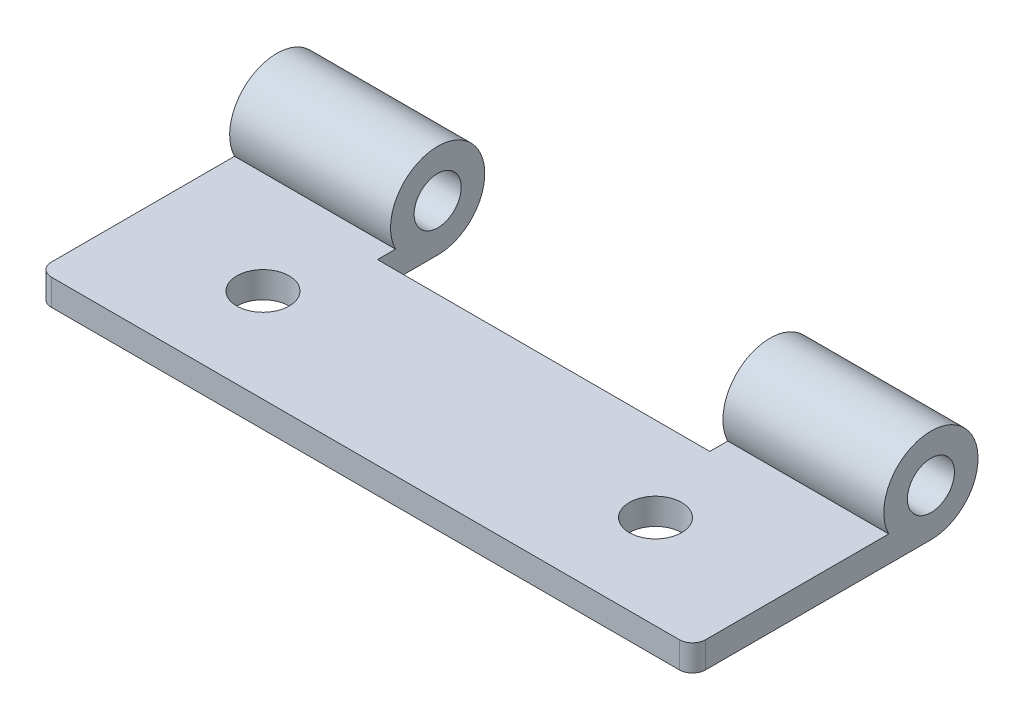
from build123d import *

# Parameters (mm, degrees)
BOSS_EXTRUDE1_DEPTH     = 25
CUT_EXTRUDE1_DEPTH      = 25
CUT_EXTRUDE1_DEPTH_BACK = 25
SKETCH4_R               = 0.9
CUT_EXTRUDE2_DEPTH      = 25
FILLET1_R               = 0.5
CUT_EXTRUDE3_DEPTH      = 25
CUT_EXTRUDE3_DEPTH_BACK = 25
SKETCH5_R               = 1


with BuildPart() as part:
    # Sketch2 → Boss-Extrude1 (new body)
    with BuildSketch(Plane(origin=(0, 0, 0), x_dir=(0, 0, -1), z_dir=(1, 0, 0))):
        with BuildLine():
            Line((0, -1.8), (-9.11245155, -1.8))
            Line((-9.11245155, -1.8), (-9.11245155, -0.8))
            Line((-9.11245155, -0.8), (-1.61245155, -0.8))
            ThreePointArc((-1.61245155, -0.8), (0.948683298, 1.529705854), (0, -1.8))
        make_face()
    extrude(amount=BOSS_EXTRUDE1_DEPTH)

    # Sketch3 → Cut-Extrude1 (cut, two sides: drawn at the far end of the back side and taken through both)
    with BuildSketch(Plane(origin=(0, 0, 0), x_dir=(1, 0, 0), z_dir=(0, 1, 0)).offset(-CUT_EXTRUDE1_DEPTH_BACK)):
        Polygon((18.85, 2.515210703), (6.15, 2.515210703), (6.15, -2.3), (12.5, -2.3), (18.85, -2.3), align=None)
    extrude(amount=CUT_EXTRUDE1_DEPTH + CUT_EXTRUDE1_DEPTH_BACK, mode=Mode.SUBTRACT)

    # Sketch4 → Cut-Extrude2 (cut)
    with BuildSketch(Plane(origin=(25, 0, 0), x_dir=(0, 0, -1), z_dir=(1, 0, 0))):
        Circle(SKETCH4_R)
    extrude(amount=-CUT_EXTRUDE2_DEPTH, mode=Mode.SUBTRACT)

    # Fillet1
    fillet1_edges = [part.edges().sort_by_distance(p)[0] for p in [
        (0, -1.3, 9.11245155),
        (25, -1.3, 9.11245155),
    ]]
    fillet(fillet1_edges, radius=FILLET1_R)

    # Sketch5 → Cut-Extrude3 (cut, two sides: drawn at the far end of the back side and taken through both)
    with BuildSketch(Plane(origin=(0, 0, 0), x_dir=(1, 0, 0), z_dir=(0, 1, 0)).offset(-CUT_EXTRUDE3_DEPTH_BACK)):
        with Locations((5, -5.525991782)):
            Circle(SKETCH5_R)
        with Locations((20, -5.525991782)):
            Circle(SKETCH5_R)
    extrude(amount=CUT_EXTRUDE3_DEPTH + CUT_EXTRUDE3_DEPTH_BACK, mode=Mode.SUBTRACT)


solid = part.part
